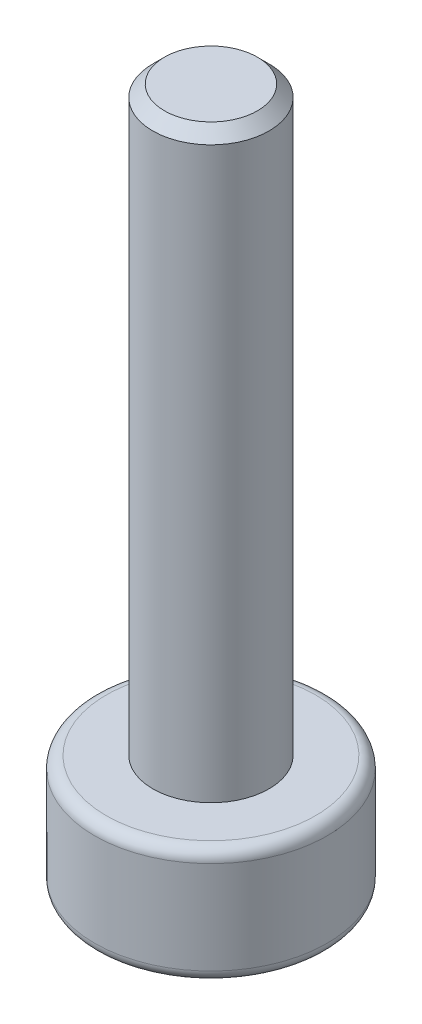
from build123d import *

# Parameters (mm, degrees)
SKETCH_2_R          = 2
EXTRUDE_1_DEPTH     = 2
SKETCH_3_R          = 1
EXTRUDE_2_DEPTH     = 10
FILLET_1_R          = 0.2
SKETCH_4_R          = 0.765
CUT_EXTRUDE_1_DEPTH = 1.52
CHAMFER_1_SIZE      = 0.1
CHAMFER_2_SIZE      = 0.2


with BuildPart() as part:
    # 草图2 → 凸台-拉伸1 (new body)
    with BuildSketch(Plane(origin=(0, 0, 0), x_dir=(1, 0, 0), z_dir=(0, 1, 0))):
        with Locations(Location((0, 0, 0), (0, 0, 270))):
            Circle(SKETCH_2_R)
    extrude(amount=EXTRUDE_1_DEPTH)

    # 草图3 → 凸台-拉伸2 (add)
    with BuildSketch(Plane(origin=(0, 2, 0), x_dir=(1, 0, 0), z_dir=(0, 1, 0))):
        with Locations(Location((0, 0, 0), (0, 0, 270))):
            Circle(SKETCH_3_R)
    extrude(amount=EXTRUDE_2_DEPTH)

    # 圆角1
    fillet_1_edges = [part.edges().sort_by_distance(p)[0] for p in [
        (0, 0, -2),
        (0, 2, -2),
    ]]
    fillet(fillet_1_edges, radius=FILLET_1_R)

    # 草图4 → 切除-拉伸1 (cut)
    with BuildSketch(Plane.XZ):
        with Locations(Location((0, 0, 0), (0, 0, 270))):
            Circle(SKETCH_4_R)
    extrude(amount=-CUT_EXTRUDE_1_DEPTH, mode=Mode.SUBTRACT)

    # 倒角1
    chamfer_1_edges = [part.edges().sort_by_distance(p)[0] for p in [
        (0, 0, 0.765),
    ]]
    chamfer(chamfer_1_edges, length=CHAMFER_1_SIZE)

    # 倒角2
    chamfer_2_edges = [part.edges().sort_by_distance(p)[0] for p in [
        (0, 12, -1),
    ]]
    chamfer(chamfer_2_edges, length=CHAMFER_2_SIZE)


solid = part.part
